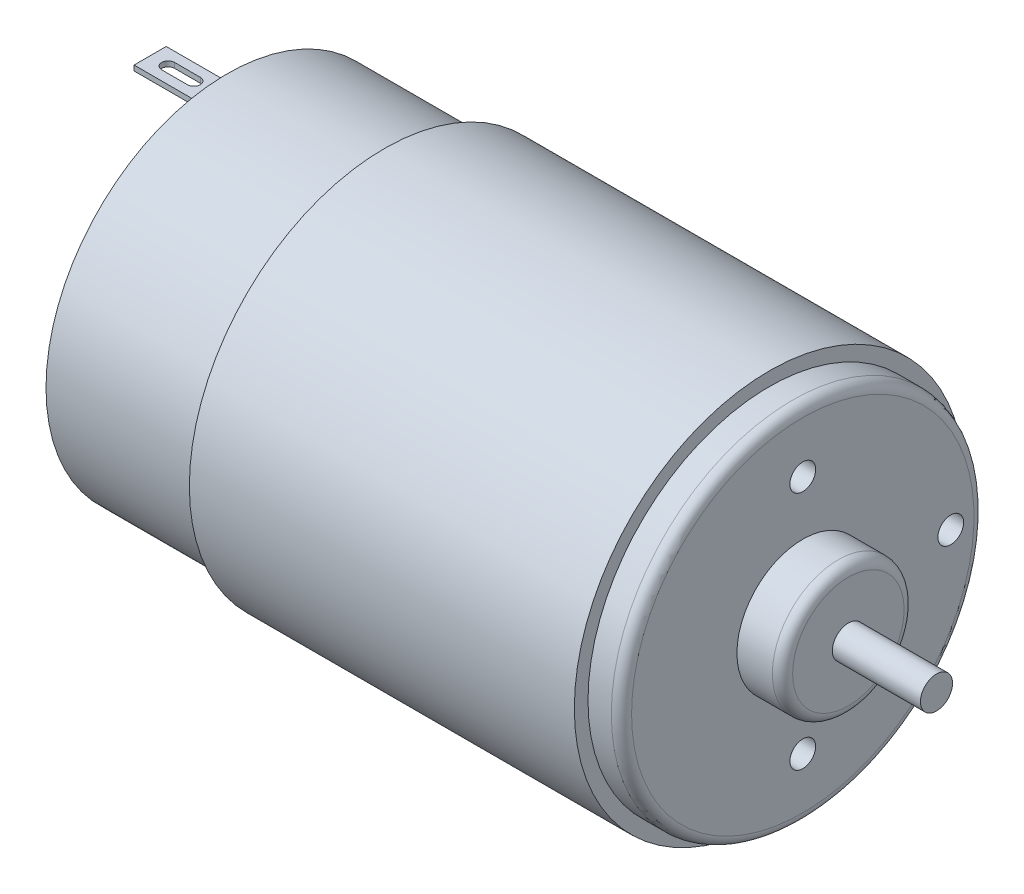
from build123d import *

# Parameters (mm, degrees)
SKETCH2_R         = 1.27
EXTRUDE1_DEPTH    = 5.08
CIRPATTERN1_COUNT = 2
SKETCH6_R         = 1.27
EXTRUDE5_DEPTH    = 5.08
EXTRUDE2_REACH    = 66.524
SKETCH4_W         = 7.62
SKETCH4_H         = 3.175
EXTRUDE3_DEPTH    = 0.51
EXTRUDE4_REACH    = 86.92
FILETE1_R         = 1


with BuildPart() as part:
    # Sketch1 → Revolve1 (revolve)
    with BuildSketch(Plane.XY, mode=Mode.PRIVATE) as revolve1_sk:
        Polygon((0, 0), (75, 0), (75, 1.585), (66.3, 1.585), (66.3, 6.5), (61.8, 6.5), (61.8, 17.900000014), (58.5, 17.900000014), (58.5, 19.249999981), (20.5, 19.249999981), (20.5, 17.900000014), (5, 17.900000014), (5, 5.1), (2, 5.1), (2, 1.585), (0, 1.585), align=None)
    revolve(revolve1_sk.sketch.rotate(Axis((0, 0, 0), (1, 0, 0)), 90), axis=Axis((0, 0, 0), (1, 0, 0)))

    # Sketch2 → Extrude1 (cut)
    with BuildSketch(Plane(origin=(61.8, 0, 0), x_dir=(0, 0, -1), z_dir=(1, 0, 0))):
        with Locations((0, 11.84)):
            Circle(SKETCH2_R)
    extrude1 = extrude(amount=-EXTRUDE1_DEPTH, mode=Mode.SUBTRACT)

    # CirPattern1: Extrude1 ×2 about axis
    cirpattern1_axis = Axis((0, 0, 0), (1, 0, 0))
    for i in range(1, CIRPATTERN1_COUNT):
        add(extrude1.rotate(cirpattern1_axis, i * 360 / CIRPATTERN1_COUNT), mode=Mode.SUBTRACT)

    # Sketch6 → Extrude5 (cut)
    with BuildSketch(Plane(origin=(61.8, 0, 0), x_dir=(0, 0, -1), z_dir=(1, 0, 0))):
        with Locations((14.605, 0)):
            Circle(SKETCH6_R)
    extrude(amount=-EXTRUDE5_DEPTH, mode=Mode.SUBTRACT)

    # Sketch3 → Extrude2 (cut, up to next)
    with BuildSketch(Plane(origin=(58.5, 0, 0), x_dir=(0, 0, -1), z_dir=(1, 0, 0)), mode=Mode.PRIVATE) as extrude2_sk1:
        with BuildLine():
            Line((17.863341667, 1.145), (19.863341667, 1.145))
            Line((19.863341667, 1.145), (19.863341667, -1.145))
            Line((19.863341667, -1.145), (17.863341667, -1.145))
            ThreePointArc((17.863341667, -1.145), (17.900000014, 0), (17.863341667, 1.145))
        make_face()
    extrude2_tool1 = extrude(extrude2_sk1.sketch, amount=-EXTRUDE2_REACH, mode=Mode.PRIVATE) & part.part
    add(extrude2_tool1.solids().sort_by_distance((58.5, 0, -18.875533))[0], mode=Mode.SUBTRACT)

    # Sketch4 → Extrude3 (add)
    with BuildSketch(Plane(origin=(0, 15.62, 0), x_dir=(-1, 0, 0), z_dir=(0, 1, 0))):
        with Locations((-1.19, 0)):
            Rectangle(SKETCH4_W, SKETCH4_H)
    extrude3 = extrude(amount=-EXTRUDE3_DEPTH)

    # Sketch5 → Extrude4 (cut, up to next)
    with BuildSketch(Plane(origin=(0, 15.62, 0), x_dir=(1, 0, 0), z_dir=(0, 1, 0)), mode=Mode.PRIVATE) as extrude4_sk1:
        with BuildLine():
            Line((-0.84, 0.635), (1.7, 0.635))
            ThreePointArc((1.7, 0.635), (2.335, 0), (1.7, -0.635))
            Line((1.7, -0.635), (-0.84, -0.635))
            ThreePointArc((-0.84, -0.635), (-1.475, 0), (-0.84, 0.635))
        make_face()
    extrude4_tool1 = extrude(extrude4_sk1.sketch, amount=-EXTRUDE4_REACH, mode=Mode.PRIVATE) & part.part
    extrude4 = extrude4_tool1.solids().sort_by_distance((0.43, 15.62, 0))[0]
    add(extrude4, mode=Mode.SUBTRACT)

    # Mirror1: Extrude3, Extrude4 across plane
    add(extrude3.mirror(Plane.ZX))
    add(extrude4.mirror(Plane.ZX), mode=Mode.SUBTRACT)

    # Filete1
    filete1_edges = [part.edges().sort_by_distance(p)[0] for p in [
        (2, 0, -5.1),
        (61.8, 0, -17.900000014),
        (66.3, 0, -6.5),
    ]]
    fillet(filete1_edges, radius=FILETE1_R)


solid = part.part
